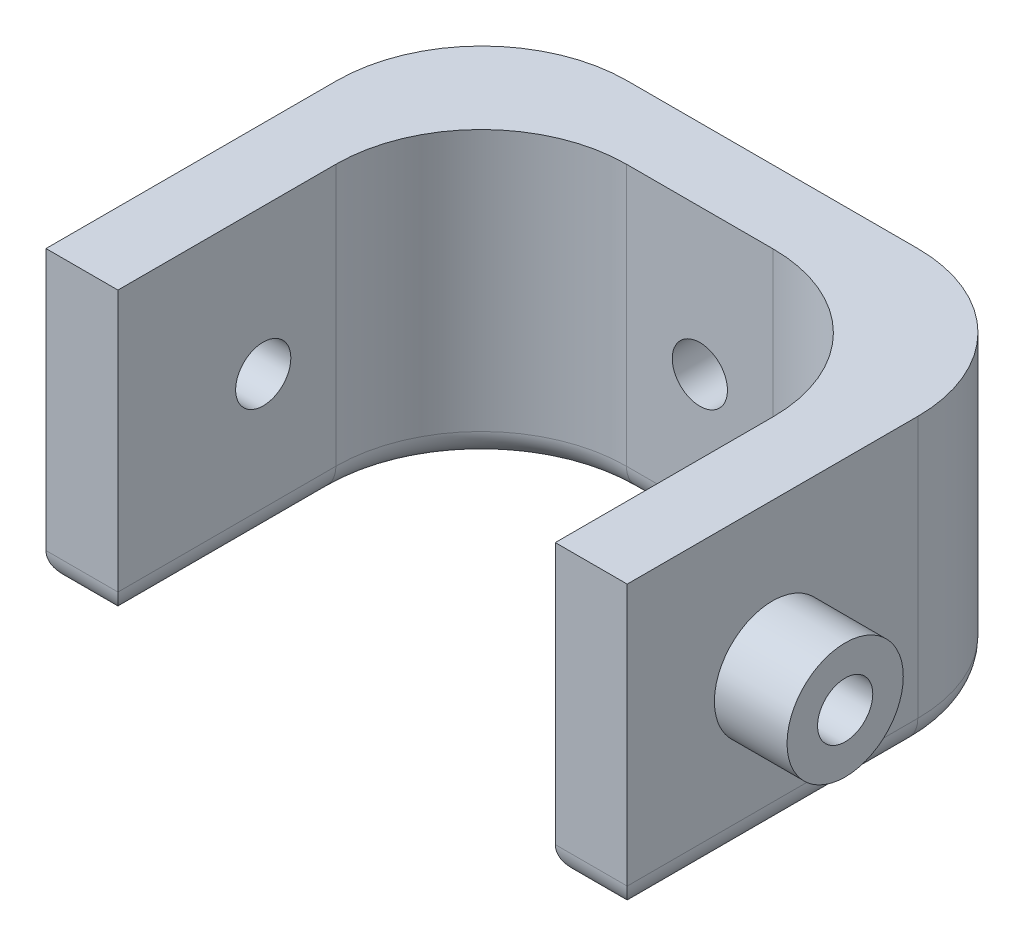
from build123d import *

# Parameters (mm, degrees)
BOSS_EXTRUDE1_DEPTH = 20
FILLET1_R           = 10
SKETCH2_R           = 4
SKETCH2_R_2         = 1.9
BOSS_EXTRUDE2_DEPTH = 5
SKETCH3_R           = 1.9
CUT_EXTRUDE1_DEPTH  = 52.478150705
SKETCH5_R           = 4
SKETCH5_R_2         = 1.9
BOSS_EXTRUDE3_DEPTH = 5
SKETCH6_R           = 1.9
CUT_EXTRUDE2_DEPTH  = 44.874821937
FILLET2_R           = 2


with BuildPart() as part:
    # Sketch1 → Boss-Extrude1 (new body)
    with BuildSketch(Plane(origin=(0, 0, 0), x_dir=(1, 0, 0), z_dir=(0, 1, 0))):
        Polygon((-20, 15), (20, 15), (20, -15), (15.05, -15), (15.05, 10), (-15.05, 10), (-15.05, -15), (-20, -15), align=None)
    extrude(amount=BOSS_EXTRUDE1_DEPTH)

    # Fillet1
    fillet1_edges = [part.edges().sort_by_distance(p)[0] for p in [
        (-20, 10, -15),
        (20, 10, -15),
        (15.05, 10, -10),
        (-15.05, 10, -10),
    ]]
    fillet(fillet1_edges, radius=FILLET1_R)

    # Sketch2 → Boss-Extrude2 (add)
    with BuildSketch(Plane(origin=(20, 0, 0), x_dir=(0, 0, -1), z_dir=(1, 0, 0))):
        with Locations(Location((-5, 10, 0), (0, 0, 180))):
            Circle(SKETCH2_R)
        with Locations((-5, 10)):
            Circle(SKETCH2_R_2, mode=Mode.SUBTRACT)
    boss_extrude2 = extrude(amount=BOSS_EXTRUDE2_DEPTH)

    # Mirror1: Boss-Extrude2 across plane
    add(boss_extrude2.mirror(Plane(origin=(0, 0, 0), x_dir=(0, 0, 1), z_dir=(1, 0, 0))))

    # Sketch3 → Cut-Extrude1 (cut, through all)
    with BuildSketch(Plane(origin=(20, 0, 0), x_dir=(0, 0, -1), z_dir=(1, 0, 0))):
        with Locations((-5, 10)):
            Circle(SKETCH3_R)
    extrude(amount=-CUT_EXTRUDE1_DEPTH, mode=Mode.SUBTRACT)

    # Sketch5 → Boss-Extrude3 (add)
    with BuildSketch(Plane(origin=(0, 0, -15), x_dir=(-1, 0, 0), z_dir=(0, 0, -1))):
        with Locations(Location((0, 10, 0), (0, 0, 180))):
            Circle(SKETCH5_R)
        with Locations((0, 10)):
            Circle(SKETCH5_R_2, mode=Mode.SUBTRACT)
    extrude(amount=BOSS_EXTRUDE3_DEPTH)

    # Sketch6 → Cut-Extrude2 (cut, through all)
    with BuildSketch(Plane(origin=(0, 0, -15), x_dir=(-1, 0, 0), z_dir=(0, 0, -1))):
        with Locations((0, 10)):
            Circle(SKETCH6_R)
    extrude(amount=-CUT_EXTRUDE2_DEPTH, mode=Mode.SUBTRACT)

    # Fillet2
    fillet2_edges = [part.edges().sort_by_distance(p)[0] for p in [
        (-15.05, 0, 7.5),
        (-17.525, 0, 15),
        (-20, 0, 5),
        (0, 0, -15),
        (15.05, 0, 7.5),
        (0, 0, -10),
        (17.071067812, 0, -12.071067812),
        (-17.071067812, 0, -12.071067812),
        (12.121067812, 0, -7.071067812),
        (-12.121067812, 0, -7.071067812),
        (20, 0, 5),
        (17.525, 0, 15),
    ]]
    fillet(fillet2_edges, radius=FILLET2_R)


solid = part.part
